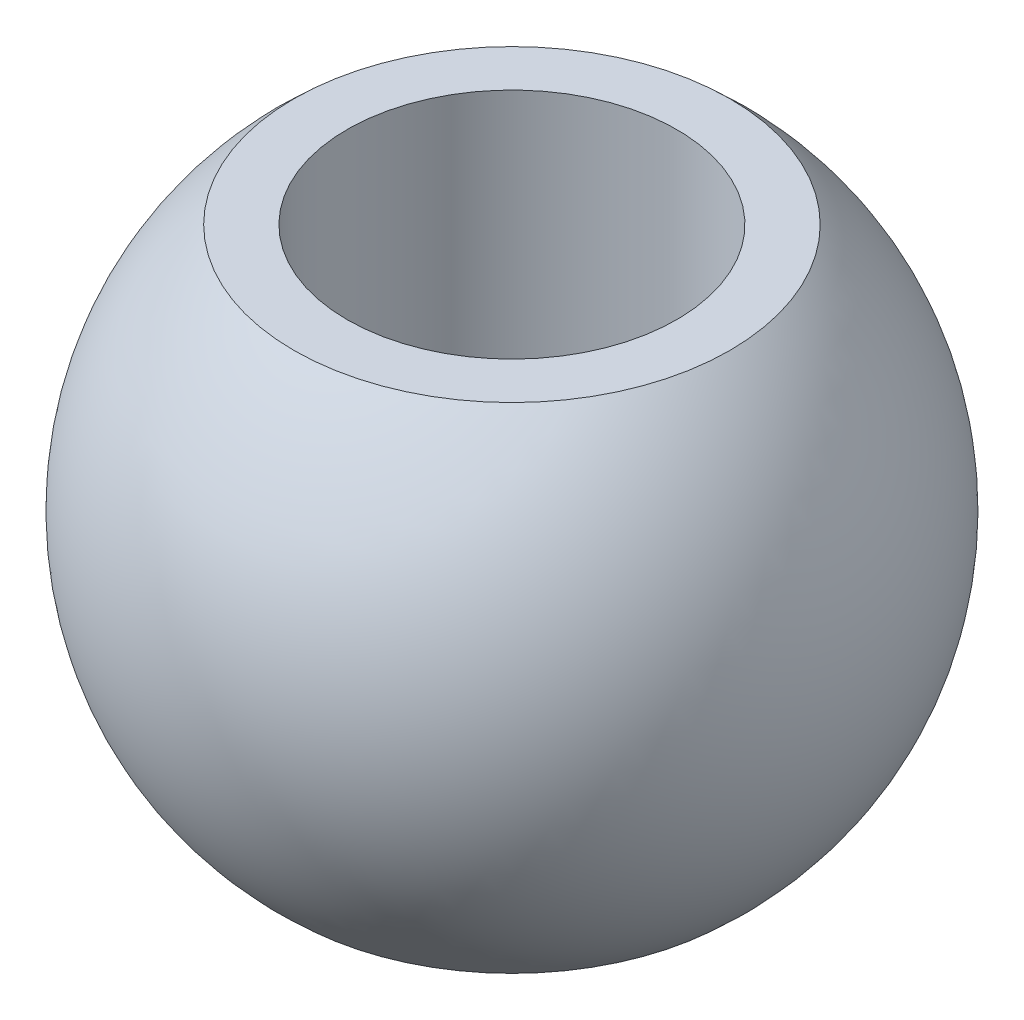
from build123d import *


with BuildPart() as part:
    # Sketch1 → Revolve3 (revolve)
    with BuildSketch(Plane.XY):
        with BuildLine():
            Line((0, 6.35), (0, -6.35))
            ThreePointArc((0, -6.35), (6.35, 0), (0, 6.35))
        make_face()
    revolve(axis=Axis((0, 6.35, 0), (0, -1, 0)))

    # Sketch2 → Cut-Revolve1 (revolve, cut)
    with BuildSketch(Plane.XY, mode=Mode.PRIVATE) as cut_revolve1_sk:
        Polygon((0, 6.35), (6.35, 6.35), (6.35, 4.7625), (3.175, 4.7625), (3.175, -4.7625), (6.35, -4.7625), (6.35, -6.35), (0, -6.35), align=None)
    revolve(cut_revolve1_sk.sketch.rotate(Axis((0, 4.7625, 0), (0, -1, 0)), 90), axis=Axis((0, 4.7625, 0), (0, -1, 0)), mode=Mode.SUBTRACT)


solid = part.part
